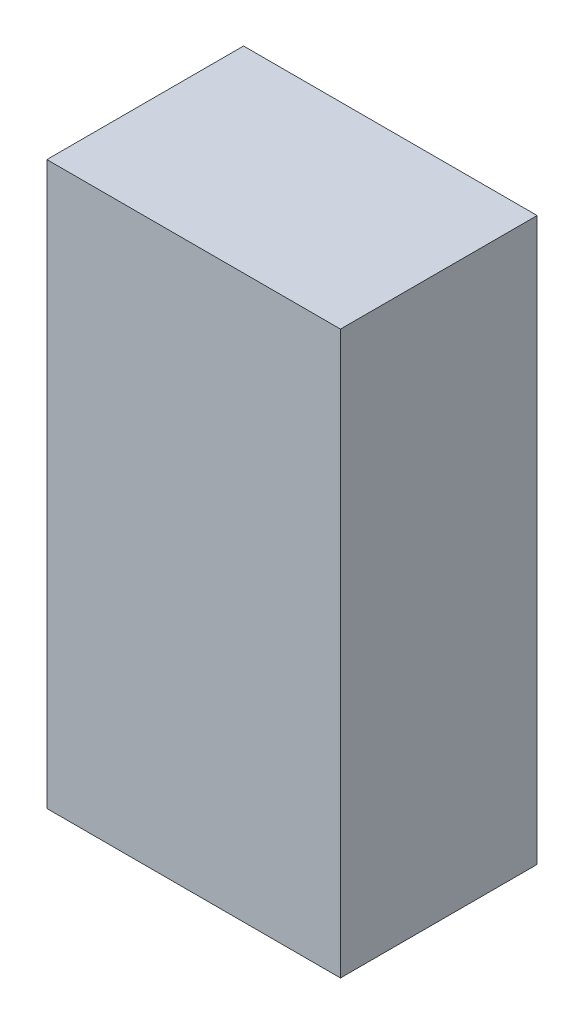
from build123d import *

# Parameters (mm, degrees)
SKETCH1_W           = 25.6
SKETCH1_H           = 17.15
BOSS_EXTRUDE1_DEPTH = 49


with BuildPart() as part:
    # Sketch1 → Boss-Extrude1 (new body)
    with BuildSketch(Plane(origin=(0, 0, 0), x_dir=(1, 0, 0), z_dir=(0, 1, 0))):
        Rectangle(SKETCH1_W, SKETCH1_H)
    extrude(amount=BOSS_EXTRUDE1_DEPTH)


solid = part.part
